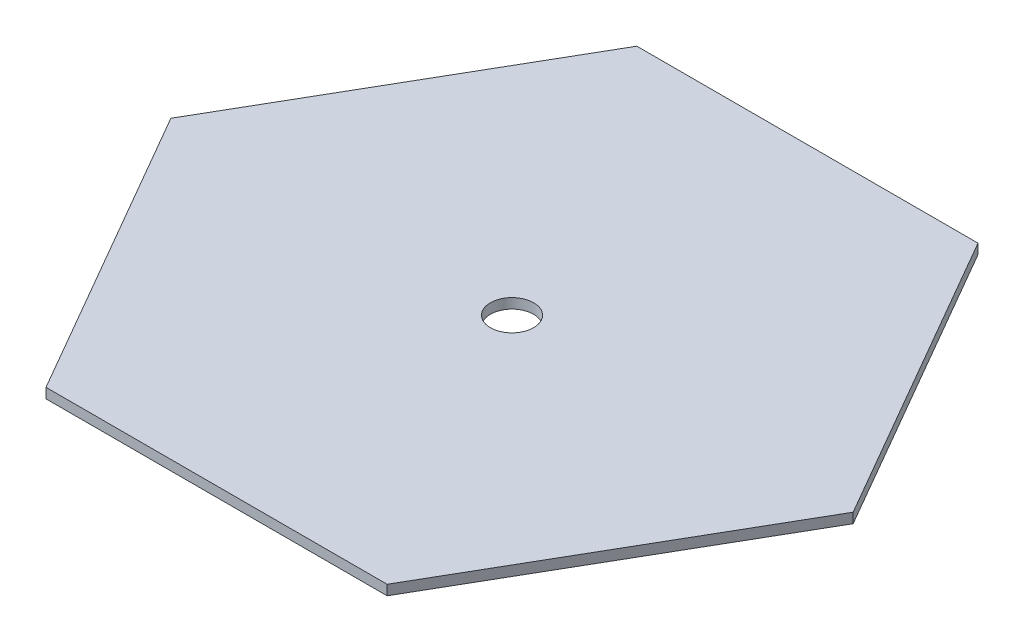
from build123d import *

# Parameters (mm, degrees)
SKETCH1_R           = 10.81
BOSS_EXTRUDE1_DEPTH = 5


with BuildPart() as part:
    # Sketch1 → Boss-Extrude1 (new body)
    with BuildSketch(Plane(origin=(0, 0, 0), x_dir=(1, 0, 0), z_dir=(0, 1, 0))):
        Polygon((85.25, -147.657331345), (170.5, 0), (85.25, 147.657331345), (-85.25, 147.657331345), (-170.5, 0), (-85.25, -147.657331345), align=None)
        with Locations(Location((0, 0, 0), (0, 0, 270))):
            Circle(SKETCH1_R, mode=Mode.SUBTRACT)
    extrude(amount=BOSS_EXTRUDE1_DEPTH)


solid = part.part
